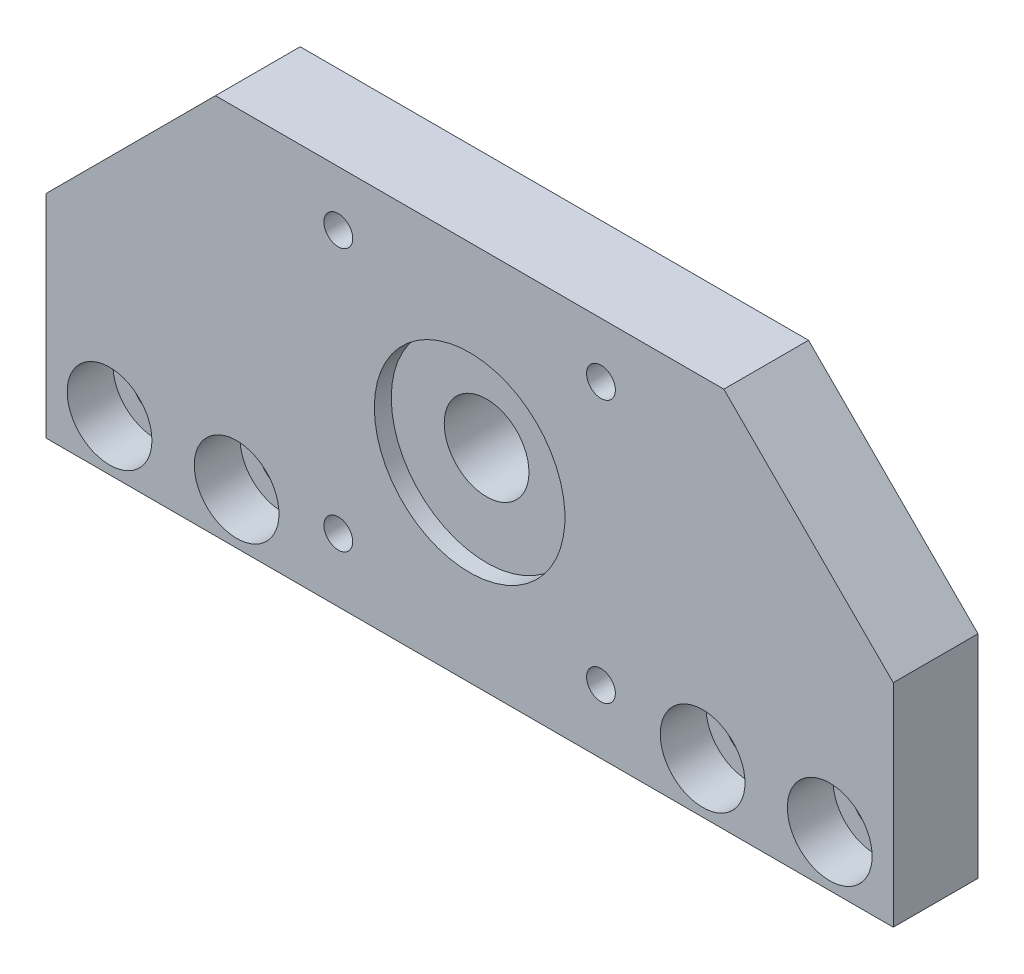
from build123d import *

# Parameters (mm, degrees)
SKETCH1_W                                           = 100
SKETCH1_H                                           = 45
BOSS_EXTRUDE1_DEPTH                                 = 5
CHAMFER1_SIZE                                       = 20
CBORE_FOR_M5_HEX_SOCKET_HEAD_CAP_SCREW2_D           = 5.5
CBORE_FOR_M5_HEX_SOCKET_HEAD_CAP_SCREW2_CBORE_D     = 10
CBORE_FOR_M5_HEX_SOCKET_HEAD_CAP_SCREW2_CBORE_DEPTH = 5.4
CBORE_FOR_M3_HEX_SOCKET_HEAD_CAP_SCREW1_D           = 3.4
CBORE_FOR_M3_HEX_SOCKET_HEAD_CAP_SCREW1_CBORE_D     = 6.5
CBORE_FOR_M3_HEX_SOCKET_HEAD_CAP_SCREW1_CBORE_DEPTH = 3.4
SKETCH2_R                                           = 5
CUT_EXTRUDE3_DEPTH                                  = 10
SKETCH12_R                                          = 11.25
CUT_EXTRUDE4_DEPTH                                  = 2


with BuildPart() as part:
    # Sketch1 → Boss-Extrude1 (new, symmetric)
    with BuildSketch(Plane.XY):
        Rectangle(SKETCH1_W, SKETCH1_H)
    extrude(amount=BOSS_EXTRUDE1_DEPTH, both=True)

    # Chamfer1
    chamfer1_edges = [part.edges().sort_by_distance(p)[0] for p in [
        (-50, 22.5, 0),
        (50, 22.5, 0),
    ]]
    chamfer(chamfer1_edges, length=CHAMFER1_SIZE)

    # CBORE for M5 Hex Socket Head Cap Screw2 (through all)
    with Locations(Plane.XY.offset(5)):
        with Locations((-42.5, -16.5), (-27.5, -16.5), (27.5, -16.5), (42.5, -16.5)):
            CounterBoreHole(CBORE_FOR_M5_HEX_SOCKET_HEAD_CAP_SCREW2_D / 2, CBORE_FOR_M5_HEX_SOCKET_HEAD_CAP_SCREW2_CBORE_D / 2, CBORE_FOR_M5_HEX_SOCKET_HEAD_CAP_SCREW2_CBORE_DEPTH)

    # CBORE for M3 Hex Socket Head Cap Screw1 (through all)
    with Locations(Plane(origin=(0, 0, -5), x_dir=(1, 0, 0), z_dir=(0, 0, -1))):
        with Locations((-15.5, -16), (15.5, -16), (15.5, 15), (-15.5, 15)):
            CounterBoreHole(CBORE_FOR_M3_HEX_SOCKET_HEAD_CAP_SCREW1_D / 2, CBORE_FOR_M3_HEX_SOCKET_HEAD_CAP_SCREW1_CBORE_D / 2, CBORE_FOR_M3_HEX_SOCKET_HEAD_CAP_SCREW1_CBORE_DEPTH)

    # Sketch2 → Cut-Extrude3 (cut)
    with BuildSketch(Plane.XY.offset(5)):
        with Locations((0, 0.5)):
            Circle(SKETCH2_R)
    extrude(amount=-CUT_EXTRUDE3_DEPTH, mode=Mode.SUBTRACT)

    # Sketch12 → Cut-Extrude4 (cut)
    with BuildSketch(Plane(origin=(0, 0, 5), x_dir=(-1, 0, 0), z_dir=(0, 0, -1))):
        Circle(SKETCH12_R)
    extrude(amount=CUT_EXTRUDE4_DEPTH, mode=Mode.SUBTRACT)


solid = part.part
